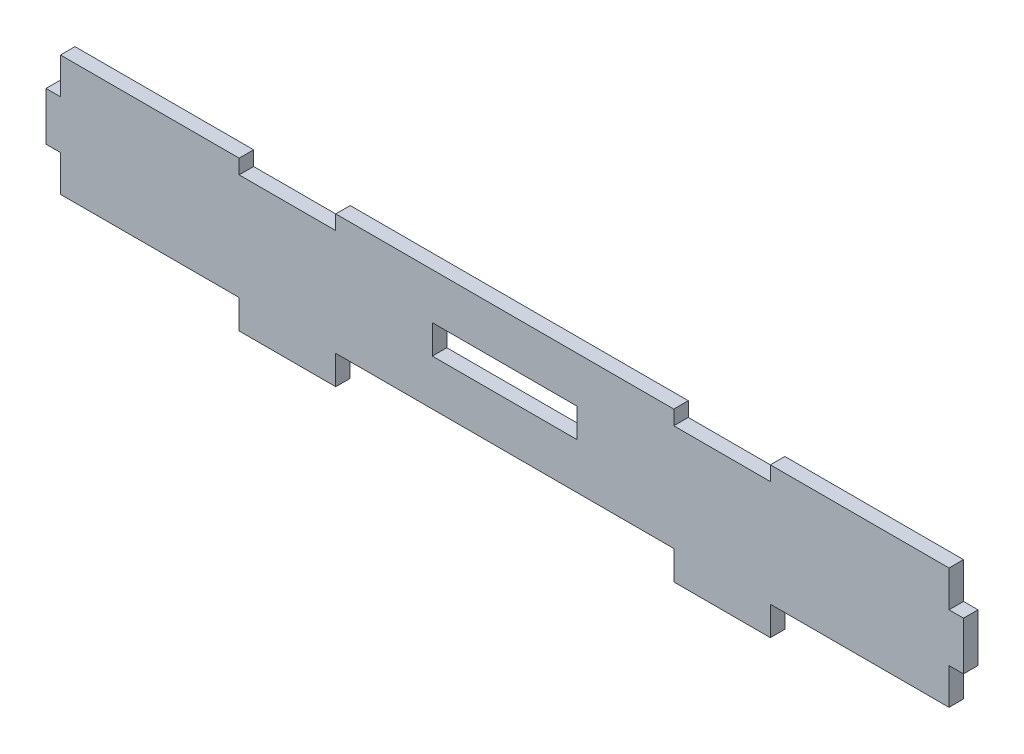
from build123d import *

# Parameters (mm, degrees)
SKETCH_1_W      = 30
SKETCH_1_H      = 6
EXTRUDE_1_DEPTH = 3


with BuildPart() as part:
    # Эскиз1 → Бобышка-Вытянуть1 (new body)
    with BuildSketch(Plane.XY):
        Polygon((57, 25), (127, 25), (127, 22), (147, 22), (147, 25), (184, 25), (184, 17.5), (187, 17.5), (187, 7.5), (184, 7.5), (184, 0), (147, 0), (147, -6), (127, -6), (127, 0), (57, 0), (57, -6), (37, -6), (37, 0), (0, 0), (0, 7.5), (-3, 7.5), (-3, 17.5), (0, 17.5), (0, 25), (37, 25), (37, 22), (57, 22), align=None)
        with Locations((92, 12.5)):
            Rectangle(SKETCH_1_W, SKETCH_1_H, mode=Mode.SUBTRACT)
    extrude(amount=EXTRUDE_1_DEPTH)


solid = part.part
